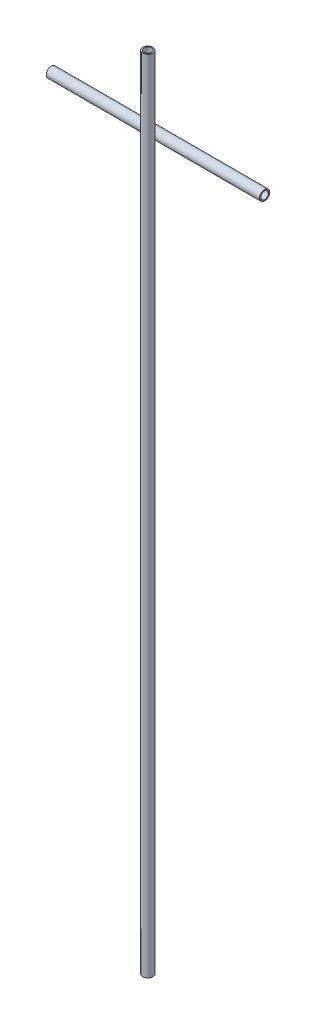
from build123d import *

# Parameters (mm, degrees)
RESSALTO_EXTRUS_O1_DEPTH      = 500
RESSALTO_EXTRUS_O1_DEPTH_BACK = 1000
ESBO_O1_R                     = 9.525
ESBO_O1_R_2                   = 7.275
RESSALTO_EXTRUS_O2_DEPTH      = 200
RESSALTO_EXTRUS_O2_DEPTH_BACK = 200
ESBO_O3_R                     = 9.525
ESBO_O3_R_2                   = 7.275


with BuildPart() as part:
    # Esboço1 → Ressalto-extrusão1 (new, two sides: drawn at the far end of the back side and taken through both)
    with BuildSketch(Plane(origin=(0, 0, 0), x_dir=(1, 0, 0), z_dir=(0, 1, 0)).offset(-RESSALTO_EXTRUS_O1_DEPTH_BACK)):
        with Locations((0, -100)):
            Circle(ESBO_O1_R)
        with Locations((0, -100)):
            Circle(ESBO_O1_R_2, mode=Mode.SUBTRACT)
    extrude(amount=RESSALTO_EXTRUS_O1_DEPTH + RESSALTO_EXTRUS_O1_DEPTH_BACK)


with BuildPart() as body_2:
    # Esboço3 → Ressalto-extrusão2 (new, two sides: drawn at the far end of the back side and taken through both)
    with BuildSketch(Plane(origin=(0, 0, 0), x_dir=(0, 0, -1), z_dir=(1, 0, 0)).offset(-RESSALTO_EXTRUS_O2_DEPTH_BACK)):
        with Locations((-80.95, 355)):
            Circle(ESBO_O3_R)
        with Locations((-80.95, 355)):
            Circle(ESBO_O3_R_2, mode=Mode.SUBTRACT)
    extrude(amount=RESSALTO_EXTRUS_O2_DEPTH + RESSALTO_EXTRUS_O2_DEPTH_BACK)


solid = Compound([part.part, body_2.part])
